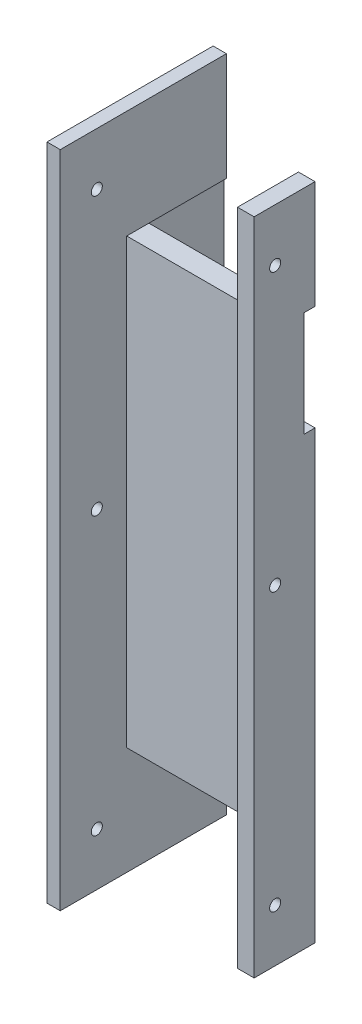
from build123d import *

# Parameters (mm, degrees)
SKETCH_1_W          = 5.5
SKETCH_1_H          = 59.5
EXTRUDE_1_DEPTH     = 1.5
SKETCH_2_W          = 3
SKETCH_2_H          = 40
EXTRUDE_2_DEPTH     = 12.5
SKETCH_3_W          = 15
SKETCH_3_H          = 59.5
EXTRUDE_3_DEPTH     = 1.2
SKETCH_4_W          = 14
SKETCH_4_H          = 9.5
CUT_EXTRUDE_1_DEPTH = 1
SKETCH_5_W          = 7
SKETCH_5_H          = 9.5
CUT_EXTRUDE_2_DEPTH = 0.2
SKETCH_6_R          = 0.5
CUT_EXTRUDE_3_DEPTH = 2.2
SKETCH_7_R          = 0.5
CUT_EXTRUDE_4_DEPTH = 4


with BuildPart() as part:
    # 草图1 → 凸台-拉伸1 (new body)
    with BuildSketch(Plane(origin=(0, 0, 0), x_dir=(0, 0, -1), z_dir=(1, 0, 0))):
        with Locations((-1.25, 0)):
            Rectangle(SKETCH_1_W, SKETCH_1_H)
    extrude(amount=EXTRUDE_1_DEPTH)

    # 草图2 → 凸台-拉伸2 (add)
    with BuildSketch(Plane.ZY):
        Rectangle(SKETCH_2_W, SKETCH_2_H)
    extrude(amount=EXTRUDE_2_DEPTH)

    # 草图3 → 凸台-拉伸3 (add)
    with BuildSketch(Plane.ZY.offset(12.5)):
        Rectangle(SKETCH_3_W, SKETCH_3_H)
    extrude(amount=EXTRUDE_3_DEPTH)

    # 草图4 → 切除-拉伸1 (cut)
    with BuildSketch(Plane(origin=(0, 0, -1.5), x_dir=(-1, 0, 0), z_dir=(0, 0, -1))):
        with Locations((5.5, 15.25)):
            Rectangle(SKETCH_4_W, SKETCH_4_H)
    extrude(amount=-CUT_EXTRUDE_1_DEPTH, mode=Mode.SUBTRACT)

    # 草图5 → 切除-拉伸2 (cut)
    with BuildSketch(Plane(origin=(-12.5, 0, 0), x_dir=(0, 0, -1), z_dir=(1, 0, 0))):
        with Locations((4, 15.25)):
            Rectangle(SKETCH_5_W, SKETCH_5_H)
    extrude(amount=-CUT_EXTRUDE_2_DEPTH, mode=Mode.SUBTRACT)

    # 草图6 → 切除-拉伸3 (cut)
    with BuildSketch(Plane(origin=(-12.5, 0, 0), x_dir=(0, 0, -1), z_dir=(1, 0, 0))):
        with Locations((-4.2, -25)):
            Circle(SKETCH_6_R)
        with Locations((3.8, -16.5)):
            Circle(SKETCH_6_R)
        with Locations((-4.2, 0)):
            Circle(SKETCH_6_R)
        with Locations((-4.2, 25)):
            Circle(SKETCH_6_R)
        with Locations((3.8, 7.5)):
            Circle(SKETCH_6_R)
    extrude(amount=-CUT_EXTRUDE_3_DEPTH, mode=Mode.SUBTRACT)

    # 草图7 → 切除-拉伸4 (cut)
    with BuildSketch(Plane(origin=(1.5, 0, 0), x_dir=(0, 0, -1), z_dir=(1, 0, 0))):
        with Locations((-2.1, -25)):
            Circle(SKETCH_7_R)
        with Locations((-2.1, 0)):
            Circle(SKETCH_7_R)
        with Locations((-2.1, 25)):
            Circle(SKETCH_7_R)
    extrude(amount=-CUT_EXTRUDE_4_DEPTH, mode=Mode.SUBTRACT)


solid = part.part
